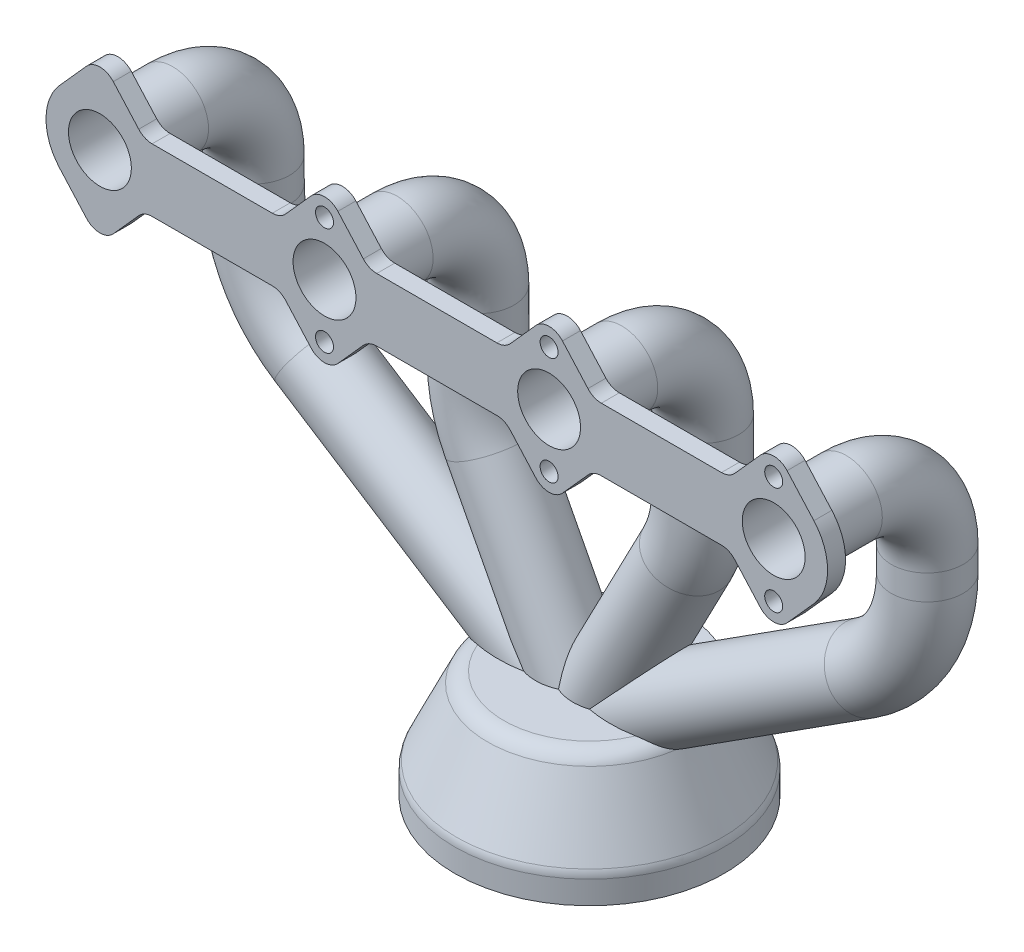
from build123d import *

# Parameters (mm, degrees)
SKETCH2_R            = 5
BOSS_EXTRUDE1_DEPTH  = 10
SWEEP1_PROFILE_R     = 20
CUT_SWEEP1_PROFILE_R = 17.5
FILLET1_R            = 10
FILLET2_R            = 10
FILLET4_R            = 10


with BuildPart() as part:
    # Sketch1 → Revolve1 (revolve)
    with BuildSketch(Plane.XY, mode=Mode.PRIVATE) as revolve1_sk:
        Polygon((-75, 0), (-75, 15), (-54.016155383, 60), (0, 60), (0, 0), align=None)
    revolve(revolve1_sk.sketch.rotate(Axis((0, 0, 0), (0, 1, 0)), 270), axis=Axis((0, 0, 0), (0, 1, 0)))



with BuildPart() as body_2:
    # Sketch2 → Boss-Extrude1 (new body)
    with BuildSketch(Plane.XY.offset(85)):
        with BuildLine():
            ThreePointArc((-180.046440075, 296.666666667), (-187.5, 300), (-194.953559925, 296.666666667))
            Line((-194.953559925, 296.666666667), (-209.860679775, 280))
            ThreePointArc((-209.860679775, 280), (-217.5, 260), (-209.860679775, 240))
            Line((-209.860679775, 240), (-194.953559925, 223.333333333))
            ThreePointArc((-194.953559925, 223.333333333), (-187.5, 220), (-180.046440075, 223.333333333))
            Line((-180.046440075, 223.333333333), (-165.139320225, 240))
            ThreePointArc((-165.139320225, 240), (-164.102752641, 241.223184082), (-163.133014138, 242.5))
            Line((-163.133014138, 242.5), (-86.866985862, 242.5))
            ThreePointArc((-86.866985862, 242.5), (-85.897247359, 241.223184082), (-84.860679775, 240))
            Line((-84.860679775, 240), (-69.953559925, 223.333333333))
            ThreePointArc((-69.953559925, 223.333333333), (-62.5, 220), (-55.046440075, 223.333333333))
            Line((-55.046440075, 223.333333333), (-40.139320225, 240))
            ThreePointArc((-40.139320225, 240), (-39.102752641, 241.223184082), (-38.133014138, 242.5))
            Line((-38.133014138, 242.5), (38.133014138, 242.5))
            ThreePointArc((38.133014138, 242.5), (39.102752641, 241.223184082), (40.139320225, 240))
            Line((40.139320225, 240), (55.046440075, 223.333333333))
            ThreePointArc((55.046440075, 223.333333333), (62.5, 220), (69.953559925, 223.333333333))
            Line((69.953559925, 223.333333333), (84.860679775, 240))
            ThreePointArc((84.860679775, 240), (85.897247359, 241.223184082), (86.866985862, 242.5))
            Line((86.866985862, 242.5), (163.133014138, 242.5))
            ThreePointArc((163.133014138, 242.5), (164.102752641, 241.223184082), (165.139320225, 240))
            Line((165.139320225, 240), (180.046440075, 223.333333333))
            ThreePointArc((180.046440075, 223.333333333), (187.5, 220), (194.953559925, 223.333333333))
            Line((194.953559925, 223.333333333), (209.860679775, 240))
            ThreePointArc((209.860679775, 240), (217.5, 260), (209.860679775, 280))
            Line((209.860679775, 280), (194.953559925, 296.666666667))
            ThreePointArc((194.953559925, 296.666666667), (187.5, 300), (180.046440075, 296.666666667))
            Line((180.046440075, 296.666666667), (165.139320225, 280))
            ThreePointArc((165.139320225, 280), (164.102752641, 278.776815918), (163.133014138, 277.5))
            Line((163.133014138, 277.5), (86.866985862, 277.5))
            ThreePointArc((86.866985862, 277.5), (85.897247359, 278.776815918), (84.860679775, 280))
            Line((84.860679775, 280), (69.953559925, 296.666666667))
            ThreePointArc((69.953559925, 296.666666667), (62.5, 300), (55.046440075, 296.666666667))
            Line((55.046440075, 296.666666667), (40.139320225, 280))
            ThreePointArc((40.139320225, 280), (39.102752641, 278.776815918), (38.133014138, 277.5))
            Line((38.133014138, 277.5), (-38.133014138, 277.5))
            ThreePointArc((-38.133014138, 277.5), (-39.102752641, 278.776815918), (-40.139320225, 280))
            Line((-40.139320225, 280), (-55.046440075, 296.666666667))
            ThreePointArc((-55.046440075, 296.666666667), (-62.5, 300), (-69.953559925, 296.666666667))
            Line((-69.953559925, 296.666666667), (-84.860679775, 280))
            ThreePointArc((-84.860679775, 280), (-85.897247359, 278.776815918), (-86.866985862, 277.5))
            Line((-86.866985862, 277.5), (-163.133014138, 277.5))
            ThreePointArc((-163.133014138, 277.5), (-164.102752641, 278.776815918), (-165.139320225, 280))
            Line((-165.139320225, 280), (-180.046440075, 296.666666667))
        make_face()
        with Locations((-62.5, 290)):
            Circle(SKETCH2_R, mode=Mode.SUBTRACT)
        with Locations((-62.5, 230)):
            Circle(SKETCH2_R, mode=Mode.SUBTRACT)
        with Locations((62.5, 290)):
            Circle(SKETCH2_R, mode=Mode.SUBTRACT)
        with Locations((62.5, 230)):
            Circle(SKETCH2_R, mode=Mode.SUBTRACT)
        with Locations((187.5, 290)):
            Circle(SKETCH2_R, mode=Mode.SUBTRACT)
        with Locations((187.5, 230)):
            Circle(SKETCH2_R, mode=Mode.SUBTRACT)
    extrude(amount=-BOSS_EXTRUDE1_DEPTH)


with BuildPart() as part_1:
    add(part.part)

    add(body_2.part)  # Sweep1 merges body 2
    # Sweep1: sweep along a curve in space
    with BuildLine() as sweep1_path:
        Line((62.5, 260, 85), (62.5, 260, 44.548109864))
        ThreePointArc((62.5, 260, 44.548109864), (62.5, 246.819805153, 12.728304711), (62.5, 215, -0.451890136))
        Line((62.5, 215, -0.451890136), (62.5, 178.360709533, -0.451890136))
        ThreePointArc((62.5, 178.360709533, -0.451890136), (60.348787648, 160.526637135, -0.451890136), (54.018556313, 143.71562812, -0.451890136))
        Line((54.018556313, 143.71562812, -0.451890136), (0, 40, -0.451890136))
        Line((0, 40, -0.451890136), (152.929027232, 137.874577428, -0.451890136))
        ThreePointArc((152.929027232, 137.874577428, -0.451890136), (178.292009554, 165.039217948, -0.451890136), (187.5, 201.044932478, -0.451890136))
        Line((187.5, 201.044932478, -0.451890136), (187.5, 215, -0.451890136))
        ThreePointArc((187.5, 215, -0.451890136), (187.5, 246.819805153, 12.728304711), (187.5, 260, 44.548109864))
        Line((187.5, 260, 44.548109864), (187.5, 260, 85))
    # Sweep1 profile (on start of the path) → Sweep1 (sweep)
    with BuildSketch(Plane(origin=(62.5, 260, 85), x_dir=(-1, 0, 0), z_dir=(0, 0, -1))):
        Circle(SWEEP1_PROFILE_R)
    sweep1 = sweep(path=sweep1_path.line, transition=Transition.RIGHT)

    # Mirror1: Sweep1 across plane
    add(sweep1.mirror(Plane(origin=(0, 0, 0), x_dir=(0, 0, 1), z_dir=(1, 0, 0))))

    # Sketch19 → Cut-Revolve3 (revolve, cut)
    with BuildSketch(Plane.XY, mode=Mode.PRIVATE) as cut_revolve3_sk:
        Polygon((-63.96622081, 0), (-63.96622081, 15), (-47.645452775, 50), (0, 50), (0, 0), align=None)
    revolve(cut_revolve3_sk.sketch.rotate(Axis((0, 0, 0), (0, 1, 0)), 180), axis=Axis((0, 0, 0), (0, 1, 0)), mode=Mode.SUBTRACT)


with BuildPart() as cut_revolve3_piece_1:
    # of the separate pieces the step leaves, piece 1, a body of its own (cut_revolve3_pieces)
    add(part_1.part.solids().sort_by_distance((0, 0, -75))[0])


with BuildPart() as cut_revolve3_piece_2:
    # of the separate pieces the step leaves, piece 2, a body of its own (cut_revolve3_pieces)
    add(part_1.part.solids().sort_by_distance((36.584440048, 0, 13.860429657))[0])


with BuildPart() as cut_revolve3_piece_3:
    # of the separate pieces the step leaves, piece 3, a body of its own (cut_revolve3_pieces)
    add(part_1.part.solids().sort_by_distance((-52.376175419, -17.266067596, -0.451890136))[0])


with BuildPart() as cut_sweep1_tool:
    # Cut-Sweep1: sweep along a curve in space
    with BuildLine() as cut_sweep1_path:
        Line((62.5, 260, 85), (62.5, 260, 44.548109864))
        ThreePointArc((62.5, 260, 44.548109864), (62.5, 246.819805153, 12.728304711), (62.5, 215, -0.451890136))
        Line((62.5, 215, -0.451890136), (62.5, 178.360709533, -0.451890136))
        ThreePointArc((62.5, 178.360709533, -0.451890136), (60.348787648, 160.526637135, -0.451890136), (54.018556313, 143.71562812, -0.451890136))
        Line((54.018556313, 143.71562812, -0.451890136), (0, 40, -0.451890136))
        Line((0, 40, -0.451890136), (152.929027232, 137.874577428, -0.451890136))
        ThreePointArc((152.929027232, 137.874577428, -0.451890136), (178.292009554, 165.039217948, -0.451890136), (187.5, 201.044932478, -0.451890136))
        Line((187.5, 201.044932478, -0.451890136), (187.5, 215, -0.451890136))
        ThreePointArc((187.5, 215, -0.451890136), (187.5, 246.819805153, 12.728304711), (187.5, 260, 44.548109864))
        Line((187.5, 260, 44.548109864), (187.5, 260, 85))
    # Cut-Sweep1 profile (on start of the path) → Cut-Sweep1 (sweep)
    with BuildSketch(Plane(origin=(62.5, 260, 85), x_dir=(-1, 0, 0), z_dir=(0, 0, -1))):
        Circle(CUT_SWEEP1_PROFILE_R)
    cut_sweep1 = sweep(path=cut_sweep1_path.line, transition=Transition.RIGHT)


with BuildPart() as cut_revolve3_piece_1_1:
    add(cut_revolve3_piece_1.part)

    # Cut-Sweep1: cut by cut_sweep1_tool
    add(cut_sweep1_tool.part, mode=Mode.SUBTRACT)


with BuildPart() as cut_revolve3_piece_3_1:
    add(cut_revolve3_piece_3.part)

    # Cut-Sweep1: cut by cut_sweep1_tool
    add(cut_sweep1_tool.part, mode=Mode.SUBTRACT)


with BuildPart() as mirror2_tool:
    # Mirror2: Cut-Sweep1 across plane
    add(cut_sweep1.mirror(Plane(origin=(0, 0, 0), x_dir=(0, 0, 1), z_dir=(1, 0, 0))))


with BuildPart() as cut_revolve3_piece_1_2:
    add(cut_revolve3_piece_1_1.part)

    # Mirror2: cut by mirror2_tool
    add(mirror2_tool.part, mode=Mode.SUBTRACT)

    # Fillet1
    fillet1_edges = [cut_revolve3_piece_1_2.edges().sort_by_distance(p)[0] for p in [
        (163.133014138, 277.5, 80),
        (86.866985862, 277.5, 80),
        (-38.133014138, 277.5, 80),
        (38.133014138, 277.5, 80),
        (-86.866985862, 277.5, 80),
        (-163.133014138, 277.5, 80),
    ]]
    fillet(fillet1_edges, radius=FILLET1_R)

    # Fillet2
    fillet2_edges = [cut_revolve3_piece_1_2.edges().sort_by_distance(p)[0] for p in [
        (-86.866985862, 242.5, 80),
        (-163.133014138, 242.5, 80),
        (-38.133014138, 242.5, 80),
        (38.133014138, 242.5, 80),
        (86.866985862, 242.5, 80),
        (163.133014138, 242.5, 80),
    ]]
    fillet(fillet2_edges, radius=FILLET2_R)

    # Fillet4
    fillet4_edges = [cut_revolve3_piece_1_2.edges().sort_by_distance(p)[0] for p in [
        (0, 15, 75),
        (0, 60, 54.016155383),
    ]]
    fillet(fillet4_edges, radius=FILLET4_R)


with BuildPart() as cut_revolve3_piece_2_1:
    add(cut_revolve3_piece_2.part)

    # Mirror2: cut by mirror2_tool
    add(mirror2_tool.part, mode=Mode.SUBTRACT)


solid = Compound([cut_revolve3_piece_3_1.part, cut_revolve3_piece_1_2.part, cut_revolve3_piece_2_1.part])
